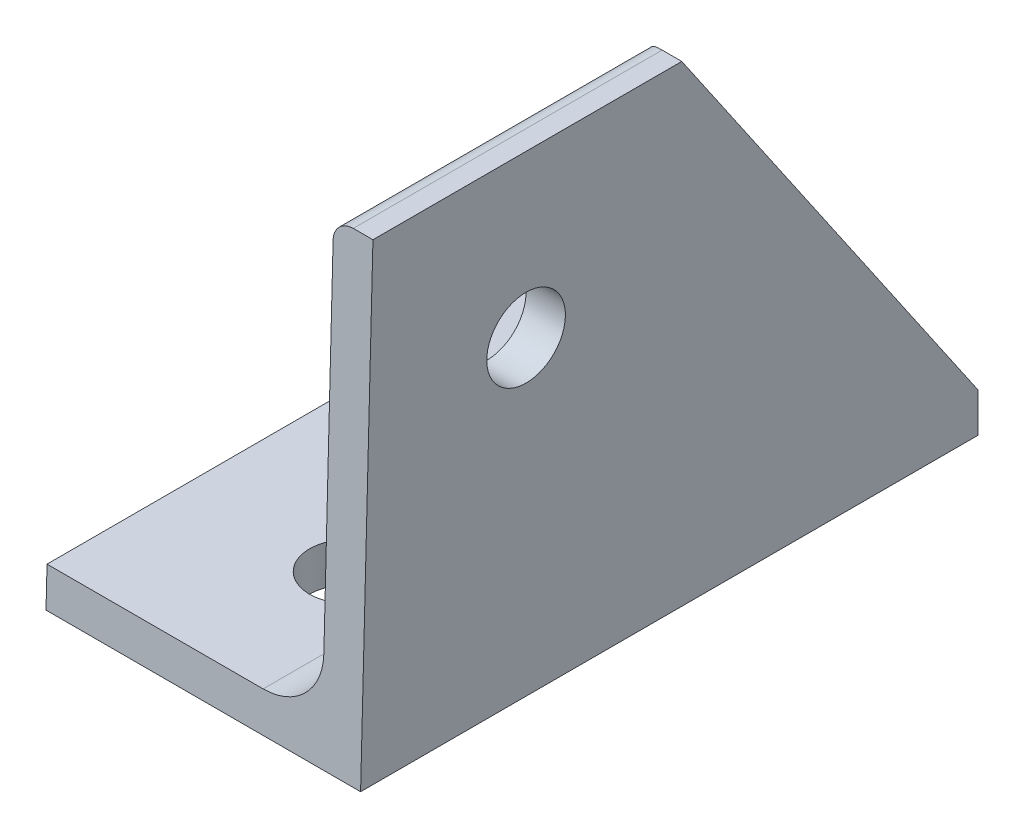
from build123d import *

# Parameters (mm, degrees)
BOSS_EXTRUDE1_DEPTH = 25.4
SKETCH3_R           = 3.175
SKETCH3_W           = 12.7
SKETCH3_H           = 50.8
CUT_EXTRUDE1_DEPTH  = 50.595085442
SKETCH12_OUTSIDE_W  = 66.478
SKETCH12_OUTSIDE_H  = 53.778
CUT_EXTRUDE2_DEPTH  = 41.659838908
SKETCH13_R          = 3.175
CUT_EXTRUDE3_DEPTH  = 41.659838908
SKETCH14_R          = 6.35
CUT_EXTRUDE4_DEPTH  = 2.54


with BuildPart() as part:
    # Sketch2 → Boss-Extrude1 (new, symmetric)
    with BuildSketch(Plane.XY):
        with BuildLine():
            Line((-19.05, -19.05), (19.05, -19.05))
            Line((19.05, -19.05), (19.05, 19.05))
            Line((19.05, 19.05), (17.4625, 19.05))
            ThreePointArc((17.4625, 19.05), (16.339967985, 18.585032015), (15.875, 17.4625))
            Line((15.875, 17.4625), (15.875, -11.0998))
            ThreePointArc((15.875, -11.0998), (14.476376302, -14.476376302), (11.0998, -15.875))
            Line((11.0998, -15.875), (-17.4625, -15.875))
            ThreePointArc((-17.4625, -15.875), (-18.585032015, -16.339967985), (-19.05, -17.4625))
            Line((-19.05, -17.4625), (-19.05, -19.05))
        make_face()
    extrude(amount=BOSS_EXTRUDE1_DEPTH, both=True)

    # Sketch3 → Cut-Extrude1 (cut, through all)
    with BuildSketch(Plane.XZ.offset(19.05)):
        with Locations((6.35, 12.7)):
            Circle(SKETCH3_R)
        with Locations((6.35, -12.7)):
            Circle(SKETCH3_R)
        with Locations((-12.7, 0)):
            Rectangle(SKETCH3_W, SKETCH3_H)
    extrude(amount=-CUT_EXTRUDE1_DEPTH, mode=Mode.SUBTRACT)

    # Sketch12 outside → Cut-Extrude2 (cut, through all)
    with BuildSketch(Plane(origin=(19.05, 0, 0), x_dir=(0, 0, -1), z_dir=(1, 0, 0))):
        Rectangle(SKETCH12_OUTSIDE_W, SKETCH12_OUTSIDE_H)
        Polygon((-23.451834826, 19.05), (1.48415665, 19.05), (25.4, -15.875), (25.4, -19.05), (-24.449518438, -19.05), align=None, mode=Mode.SUBTRACT)
    extrude(amount=-CUT_EXTRUDE2_DEPTH, mode=Mode.SUBTRACT)

    # Sketch13 → Cut-Extrude3 (cut, through all)
    with BuildSketch(Plane(origin=(19.05, 0, 0), x_dir=(0, 0, -1), z_dir=(1, 0, 0))):
        with Locations(Location((-11.088634042, 6.021904729, 0), (0, 0, 90))):
            Circle(SKETCH13_R)
    extrude(amount=-CUT_EXTRUDE3_DEPTH, mode=Mode.SUBTRACT)

    # Sketch14 → Cut-Extrude4 (cut)
    with BuildSketch(Plane(origin=(0, -15.875, 0), x_dir=(1, 0, 0), z_dir=(0, 1, 0))):
        with Locations((6.35, 12.7)):
            Circle(SKETCH14_R)
        with Locations((6.35, -12.7)):
            Circle(SKETCH14_R)
    extrude(amount=CUT_EXTRUDE4_DEPTH, mode=Mode.SUBTRACT)


solid = part.part
